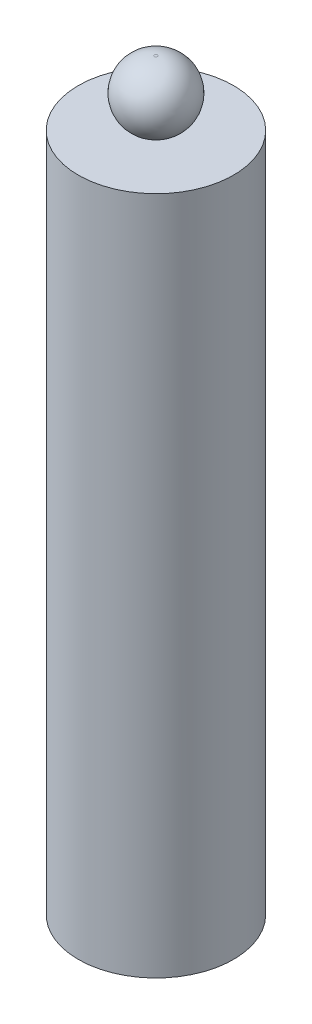
from build123d import *

# Parameters (mm, degrees)
SKETCH1_R           = 24
BOSS_EXTRUDE1_DEPTH = 230


with BuildPart() as part:
    # Sketch1 → Boss-Extrude1 (new body)
    with BuildSketch(Plane(origin=(0, 0, 0), x_dir=(1, 0, 0), z_dir=(0, 1, 0))):
        with Locations(Location((0, 0, 0), (0, 0, 270))):
            Circle(SKETCH1_R)
    extrude(amount=BOSS_EXTRUDE1_DEPTH)

    # Sketch3 → Cut-Revolve2 (revolve, cut)
    with BuildSketch(Plane.XY, mode=Mode.PRIVATE) as cut_revolve2_sk:
        with BuildLine():
            Line((24, 230), (24, 210))
            Line((24, 210), (0.5, 210))
            ThreePointArc((0.5, 210), (10.5, 220), (0.5, 230))
            Line((0.5, 230), (24, 230))
        make_face()
    revolve(cut_revolve2_sk.sketch.rotate(Axis((0, 241.465420533, 0), (0, -1, 0)), 180), axis=Axis((0, 241.465420533, 0), (0, -1, 0)), mode=Mode.SUBTRACT)


solid = part.part
